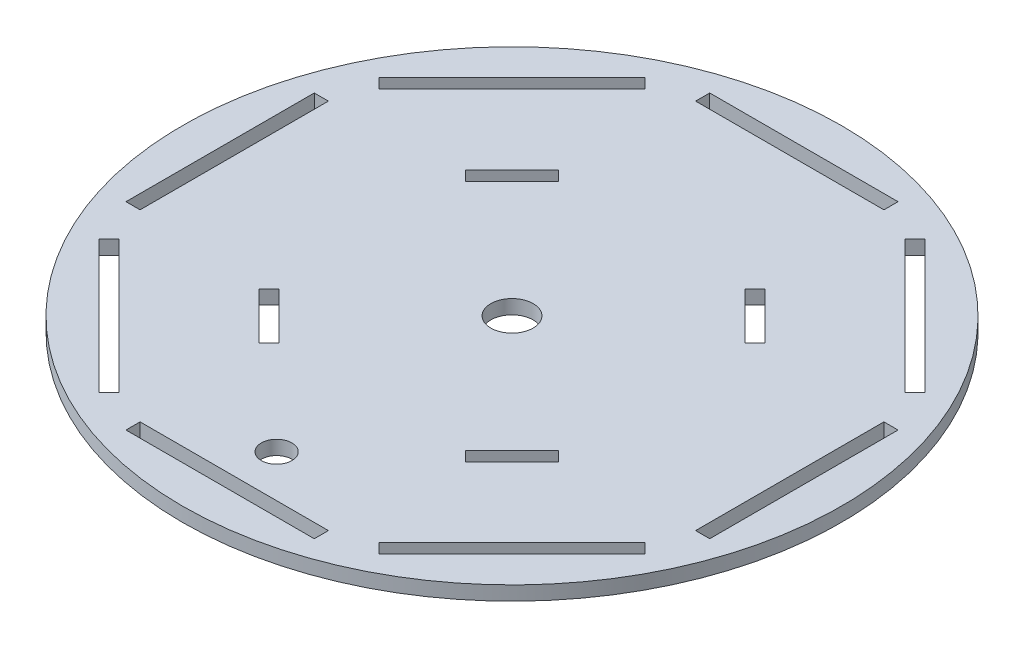
from build123d import *

# Parameters (mm, degrees)
CROQUIS1_R              = 70
CROQUIS1_R_2            = 4.5
CROQUIS1_R_3            = 3.25
SALIENTE_EXTRUIR1_DEPTH = 3


with BuildPart() as part:
    # Croquis1 → Saliente-Extruir1 (new body)
    with BuildSketch(Plane(origin=(0, 0, 0), x_dir=(1, 0, 0), z_dir=(0, 1, 0))):
        with Locations(Location((0, 0, 0), (0, 0, 270))):
            Circle(CROQUIS1_R)
        with Locations(Location((0, 0, 0), (0, 0, 270))):
            Circle(CROQUIS1_R_2, mode=Mode.SUBTRACT)
        with Locations(Location((0, -50, 0), (0, 0, 270))):
            Circle(CROQUIS1_R_3, mode=Mode.SUBTRACT)
        Polygon((24.748737342, 24.748737342), (29.69848481, 19.798989873), (31.819805153, 21.920310217), (21.920310217, 31.819805153), (19.798989873, 29.69848481), align=None, mode=Mode.SUBTRACT)
        Polygon((24.748737342, -24.748737342), (19.798989873, -29.69848481), (21.920310217, -31.819805153), (31.819805153, -21.920310217), (29.69848481, -19.798989873), align=None, mode=Mode.SUBTRACT)
        Polygon((-24.748737342, 24.748737342), (-19.798989873, 29.69848481), (-21.920310217, 31.819805153), (-31.819805153, 21.920310217), (-29.69848481, 19.798989873), align=None, mode=Mode.SUBTRACT)
        Polygon((-24.748737342, -24.748737342), (-29.69848481, -19.798989873), (-31.819805153, -21.920310217), (-21.920310217, -31.819805153), (-19.798989873, -29.69848481), align=None, mode=Mode.SUBTRACT)
        Polygon((0, 62), (20, 62), (20, 59), (-20, 59), (-20, 62), align=None, mode=Mode.SUBTRACT)
        Polygon((55.861435714, 27.577164466), (27.577164466, 55.861435714), (29.69848481, 57.982756057), (43.840620434, 43.840620434), (57.982756057, 29.69848481), align=None, mode=Mode.SUBTRACT)
        Polygon((59, -20), (59, 20), (62, 20), (62, 0), (62, -20), align=None, mode=Mode.SUBTRACT)
        Polygon((27.577164466, -55.861435714), (55.861435714, -27.577164466), (57.982756057, -29.69848481), (43.840620434, -43.840620434), (29.69848481, -57.982756057), align=None, mode=Mode.SUBTRACT)
        Polygon((-20, -59), (20, -59), (20, -62), (0, -62), (-20, -62), align=None, mode=Mode.SUBTRACT)
        Polygon((-55.861435714, -27.577164466), (-27.577164466, -55.861435714), (-29.69848481, -57.982756057), (-43.840620434, -43.840620434), (-57.982756057, -29.69848481), align=None, mode=Mode.SUBTRACT)
        Polygon((-59, 20), (-59, -20), (-62, -20), (-62, 0), (-62, 20), align=None, mode=Mode.SUBTRACT)
        Polygon((-27.577164466, 55.861435714), (-55.861435714, 27.577164466), (-57.982756057, 29.69848481), (-43.840620434, 43.840620434), (-29.69848481, 57.982756057), align=None, mode=Mode.SUBTRACT)
    extrude(amount=SALIENTE_EXTRUIR1_DEPTH)


solid = part.part
